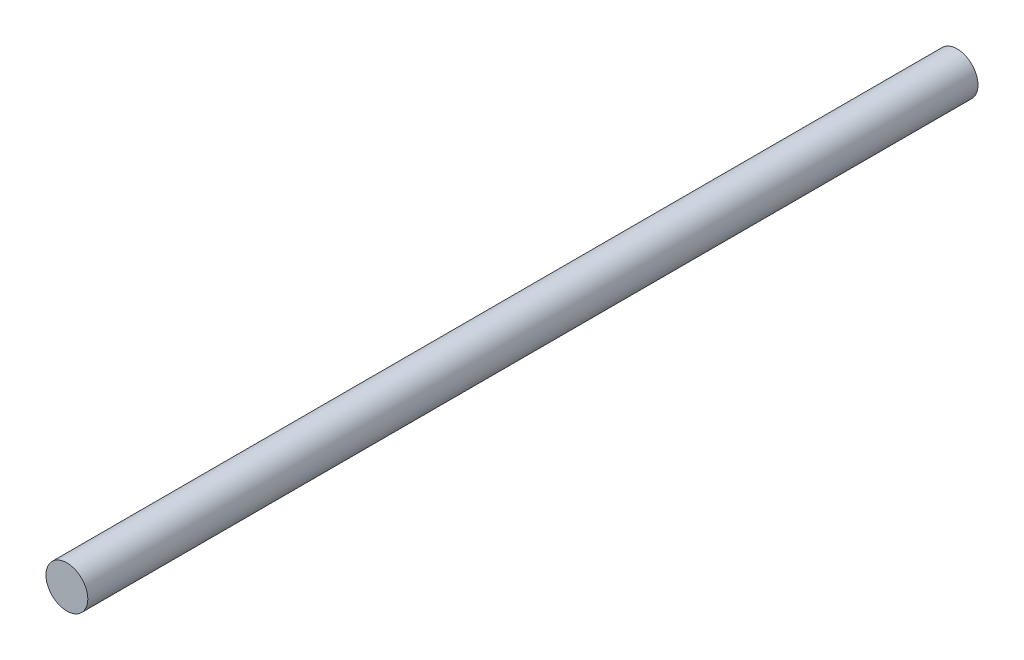
from build123d import *

# Parameters (mm, degrees)
SKETCH2_R           = 18.8
BOSS_EXTRUDE1_DEPTH = 800


with BuildPart() as part:
    # Sketch2 → Boss-Extrude1 (new body)
    with BuildSketch(Plane.XY):
        Circle(SKETCH2_R)
    extrude(amount=-BOSS_EXTRUDE1_DEPTH)


solid = part.part
